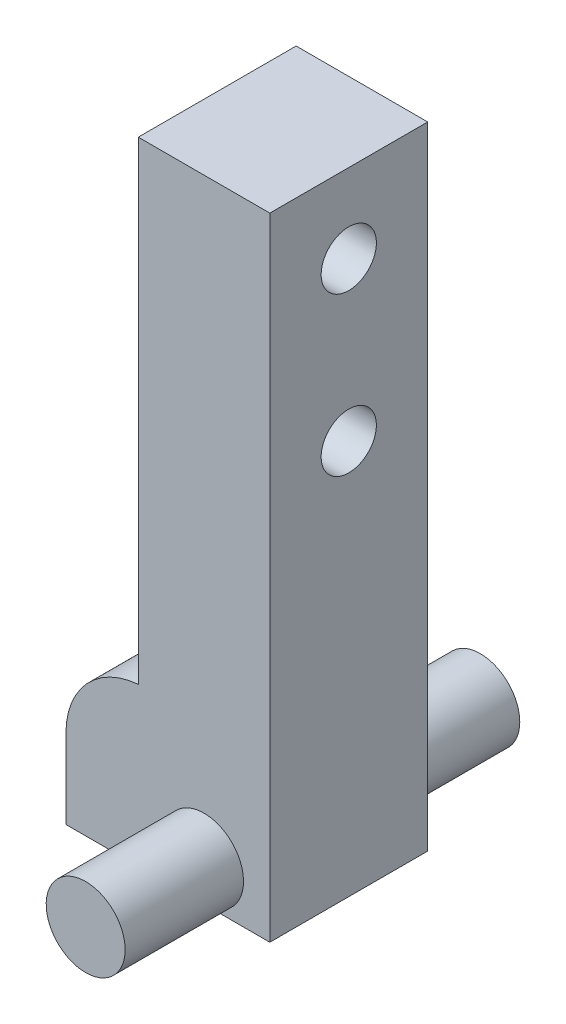
from build123d import *

# Parameters (mm, degrees)
BASE_EXTRUDE_DEPTH = 12
SKETCH4_R          = 3
PIVOTPIN_DEPTH     = 15
M5_X_0_8_1_D       = 4.2
M5_X_0_8_1_DEPTH   = 12
M5_X_0_8_1_TIP     = 1.2618073
M5_DRILLED2_D      = 4.2
M5_DRILLED2_DEPTH  = 12
M5_DRILLED2_TIP    = 1.2618073


with BuildPart() as part:
    # Sketch3 → Base-Extrude (new body)
    with BuildSketch(Plane.XY):
        with BuildLine():
            Line((-15.5, 0), (0, 0))
            Line((0, 0), (0, 48))
            Line((0, 48), (-10, 48))
            Line((-10, 48), (-10, 11.979130372))
            ThreePointArc((-10, 11.979130372), (-13.915880433, 10.062019202), (-15.5, 6))
            Line((-15.5, 6), (-15.5, 0))
        make_face()
    extrude(amount=BASE_EXTRUDE_DEPTH)

    # Sketch4 → PivotPin (add, symmetric)
    with BuildSketch(Plane.XY.offset(6)):
        with Locations(Location((-5, 3, 0), (0, 0, 270))):
            Circle(SKETCH4_R)
    extrude(amount=PIVOTPIN_DEPTH, both=True)

    # M5 x 0.8 #1
    with Locations(Plane(origin=(-10, -42.79947187, 57.720392954), x_dir=(0, 0, 1), z_dir=(-1, 0, 0))):
        with Locations((-51.720392954, 84.79947187)):
            Hole(M5_X_0_8_1_D / 2, depth=M5_X_0_8_1_DEPTH)
            with Locations((0, 0, -(M5_X_0_8_1_DEPTH + M5_X_0_8_1_TIP / 2))):  # 118° drill point
                Cone(0, M5_X_0_8_1_D / 2, M5_X_0_8_1_TIP, mode=Mode.SUBTRACT)

    # M5 Drilled2
    with Locations(Plane(origin=(-10, -44.641735567, 57.583928977), x_dir=(0, 0, 1), z_dir=(-1, 0, 0))):
        with Locations((-51.583928977, 74.641735567)):
            Hole(M5_DRILLED2_D / 2, depth=M5_DRILLED2_DEPTH)
            with Locations((0, 0, -(M5_DRILLED2_DEPTH + M5_DRILLED2_TIP / 2))):  # 118° drill point
                Cone(0, M5_DRILLED2_D / 2, M5_DRILLED2_TIP, mode=Mode.SUBTRACT)


solid = part.part
